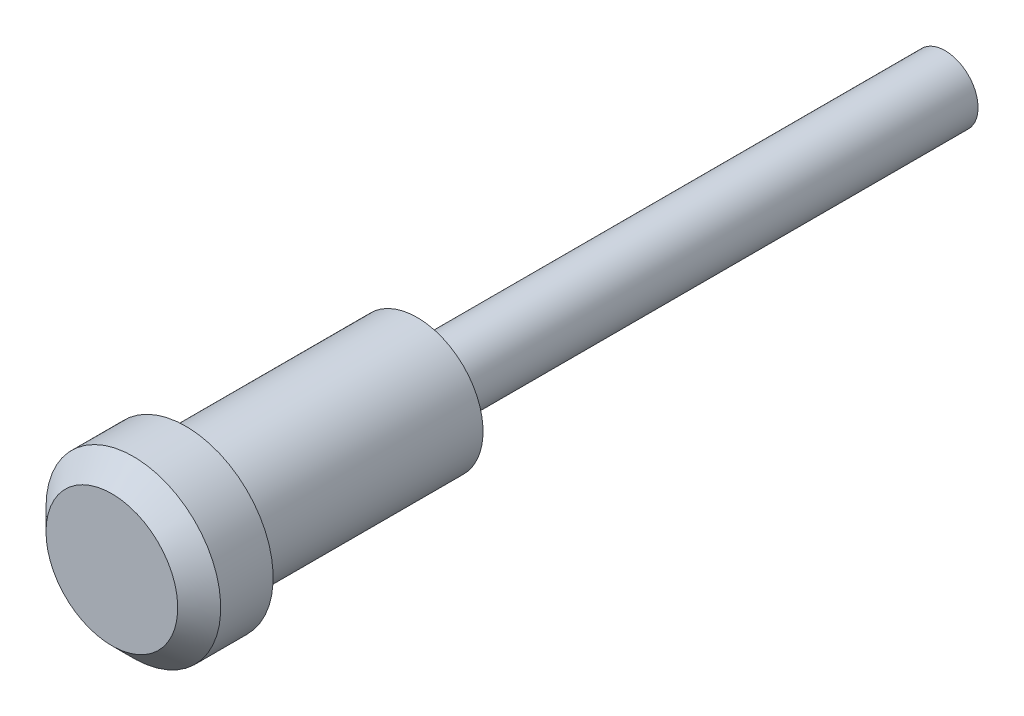
from build123d import *


with BuildPart() as part:
    # Sketch1 → Revolve1 (revolve)
    with BuildSketch(Plane(origin=(0, 0, 0), x_dir=(0, 0, -1), z_dir=(1, 0, 0)), mode=Mode.PRIVATE) as revolve1_sk:
        Polygon((0, 6.35), (-22.309799068, 6.35), (-22.309799068, 8.423469388), (-27.363880701, 8.423469388), (-29.437350089, 6.35), (-29.437350089, 0), (50.903704825, 0), (50.903704825, 3.175), (0, 3.175), align=None)
    revolve(revolve1_sk.sketch.rotate(Axis((0, 0, 0), (0, 0, 1)), 90), axis=Axis((0, 0, 0), (0, 0, 1)))


solid = part.part
